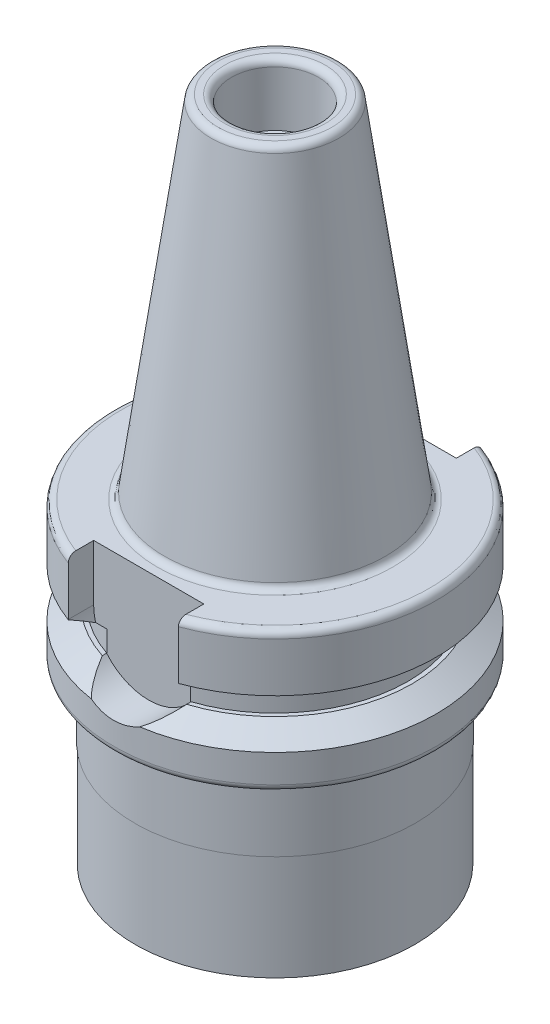
from build123d import *

# Parameters (mm, degrees)
FILLET1_R      = 1
EXTRUDE1_DEPTH = 5


with BuildPart() as part:
    # Sketch1 → Revolve1 (revolve)
    with BuildSketch(Plane.XY):
        Polygon((9, 70), (6.2, 70), (6.2, 61.15), (4, 61.15), (4, 9.233567136), (10.4637859, 9.233567136), (15.275, -25), (19.945, -25), (19.945, -10), (20, -10), (20, 0), (23, 0), (23, 5), (19.56, 7), (18.96, 7), (18.96, 10), (19.56, 10), (23, 12), (23, 20), (15.9, 20), align=None)
    revolve(axis=Axis((0, 0, 0), (0, 1, 0)))

    # Fillet1
    fillet1_edges = [part.edges().sort_by_distance(p)[0] for p in [
        (-6.2, 70, 0),
        (-9, 70, 0),
        (-15.9, 20, 0),
        (-23, 20, 0),
        (-23, 0, 0),
        (-20, 0, 0),
    ]]
    fillet(fillet1_edges, radius=FILLET1_R)

    # Sketch2 → Extrude1 (cut)
    with BuildSketch(Plane(origin=(0, 15.5, 23), x_dir=(-1, 0, 0), z_dir=(0, 0, 1))):
        with BuildLine():
            Line((-7.85, -4.5), (-7.85, 3.45))
            ThreePointArc((-7.85, 3.45), (0, 11.3), (7.85, 3.45))
            Line((7.85, 3.45), (7.85, -4.5))
            Line((7.85, -4.5), (-7.85, -4.5))
        make_face()
    extrude1 = extrude(amount=-EXTRUDE1_DEPTH, mode=Mode.SUBTRACT)

    # Mirror1: Extrude1 across plane
    add(extrude1.mirror(Plane.XY), mode=Mode.SUBTRACT)


solid = part.part
